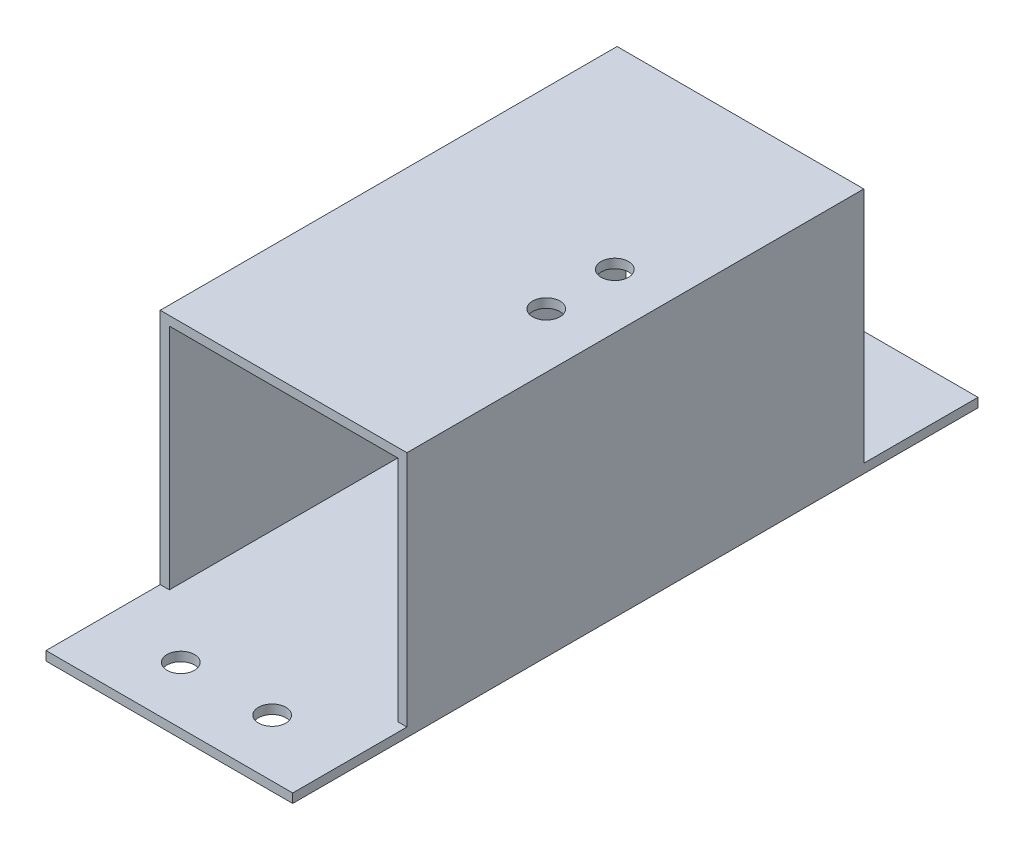
from build123d import *

# Parameters (mm, degrees)
SKETCH1_W                = 54
SKETCH1_H                = 54
SKETCH1_W_2              = 50
SKETCH1_H_2              = 50
BOSS_EXTRUDE1_DEPTH      = 50
BOSS_EXTRUDE2_DEPTH      = 25
BOSS_EXTRUDE2_DEPTH_BACK = 125
SKETCH2_W                = 54
SKETCH2_H                = 2
SKETCH3_R                = 3
CUT_EXTRUDE1_DEPTH       = 25
SKETCH4_R                = 3
CUT_EXTRUDE2_DEPTH       = 25


with BuildPart() as part:
    # Sketch1 → Boss-Extrude1 (new, symmetric)
    with BuildSketch(Plane.XY):
        Rectangle(SKETCH1_W, SKETCH1_H)
        Rectangle(SKETCH1_W_2, SKETCH1_H_2, mode=Mode.SUBTRACT)
    extrude(amount=BOSS_EXTRUDE1_DEPTH, both=True)

    # Sketch2 → Boss-Extrude2 (add, two sides: drawn at the far end of the back side and taken through both)
    with BuildSketch(Plane.XY.offset(50).offset(-BOSS_EXTRUDE2_DEPTH_BACK)):
        with Locations((0, -26)):
            Rectangle(SKETCH2_W, SKETCH2_H)
    extrude(amount=BOSS_EXTRUDE2_DEPTH + BOSS_EXTRUDE2_DEPTH_BACK)

    # Sketch3 → Cut-Extrude1 (cut)
    with BuildSketch(Plane(origin=(0, -25, 0), x_dir=(1, 0, 0), z_dir=(0, 1, 0))):
        with Locations(Location((-10, -62.5, 0), (0, 0, 180))):
            Circle(SKETCH3_R)
        with Locations(Location((10, -62.5, 0), (0, 0, 180))):
            Circle(SKETCH3_R)
        with Locations(Location((10, 62.5, 0), (0, 0, 180))):
            Circle(SKETCH3_R)
        with Locations(Location((-10, 62.5, 0), (0, 0, 180))):
            Circle(SKETCH3_R)
    extrude(amount=-CUT_EXTRUDE1_DEPTH, mode=Mode.SUBTRACT)

    # Sketch4 → Cut-Extrude2 (cut)
    with BuildSketch(Plane(origin=(0, 27, 0), x_dir=(1, 0, 0), z_dir=(0, 1, 0))):
        with Locations(Location((15, 7.5, 0), (0, 0, 180))):
            Circle(SKETCH4_R)
        with Locations(Location((15, -7.5, 0), (0, 0, 180))):
            Circle(SKETCH4_R)
    extrude(amount=-CUT_EXTRUDE2_DEPTH, mode=Mode.SUBTRACT)


solid = part.part
